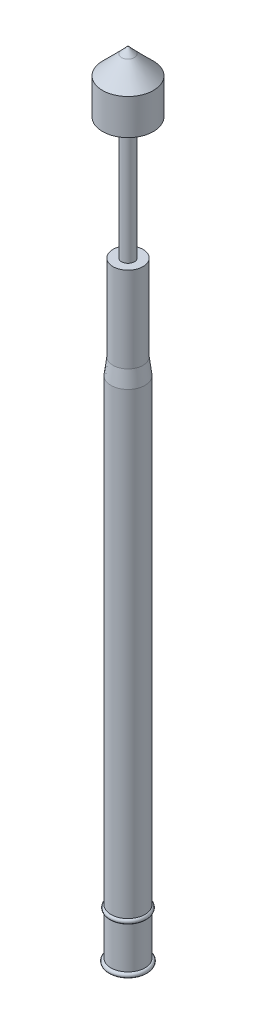
from build123d import *

# Parameters (mm, degrees)
SKETCH_1_R      = 0.835
EXTRUDE_1_DEPTH = 25
SKETCH_2_R      = 0.735
EXTRUDE_2_DEPTH = 5
SKETCH_3_R      = 0.32
EXTRUDE_3_DEPTH = 9


with BuildPart() as part:
    # 草图1 → 凸台-拉伸1 (new body)
    with BuildSketch(Plane(origin=(0, 0, 0), x_dir=(1, 0, 0), z_dir=(0, 1, 0))):
        with Locations(Location((0, 0, 0), (0, 0, 270))):
            Circle(SKETCH_1_R)
    extrude(amount=EXTRUDE_1_DEPTH)

    # 草图2 → 凸台-拉伸2 (add)
    with BuildSketch(Plane(origin=(0, 25, 0), x_dir=(1, 0, 0), z_dir=(0, 1, 0))):
        with Locations(Location((0, 0, 0), (0, 0, 270))):
            Circle(SKETCH_2_R)
    extrude(amount=EXTRUDE_2_DEPTH)

    # 草图3 → 凸台-拉伸3 (add)
    with BuildSketch(Plane(origin=(0, 30, 0), x_dir=(1, 0, 0), z_dir=(0, 1, 0))):
        with Locations(Location((0, 0, 0), (0, 0, 270))):
            Circle(SKETCH_3_R)
    extrude(amount=EXTRUDE_3_DEPTH)

    # 草图5 → 旋转1 (revolve)
    with BuildSketch(Plane.XY, mode=Mode.PRIVATE) as revolve_1_sk:
        Polygon((0.835, 25), (0.735, 25.8), (0.735, 25), align=None)
        with BuildLine():
            Line((0.835, 0.23), (0.835, 0))
            ThreePointArc((0.835, 0), (0.95, 0.115), (0.835, 0.23))
        make_face()
        with BuildLine():
            Line((0.835, 2.5), (0.835, 2.27))
            ThreePointArc((0.835, 2.27), (0.915, 2.385), (0.835, 2.5))
        make_face()
    revolve(revolve_1_sk.sketch.rotate(Axis((0, 0, 0), (0, 1, 0)), 90), axis=Axis((0, 0, 0), (0, 1, 0)))

    # 草图6 → 旋转2 (revolve)
    with BuildSketch(Plane.XY, mode=Mode.PRIVATE) as revolve_2_sk:
        Polygon((0, 39), (-1.25, 37.75), (-1.25, 36), (0, 36), align=None)
    revolve(revolve_2_sk.sketch.rotate(Axis((0, 0, 0), (0, -1, 0)), 90), axis=Axis((0, 0, 0), (0, -1, 0)))

    # 草图7 → 切除-旋转5 (revolve, cut)
    with BuildSketch(Plane.XY, mode=Mode.PRIVATE) as cut_revolve_5_sk:
        Polygon((0.32, 39), (0.02, 39), (0.32, 38.68), align=None)
    revolve(cut_revolve_5_sk.sketch.rotate(Axis((0, 0, 0), (0, -1, 0)), 270), axis=Axis((0, 0, 0), (0, -1, 0)), mode=Mode.SUBTRACT)


solid = part.part
